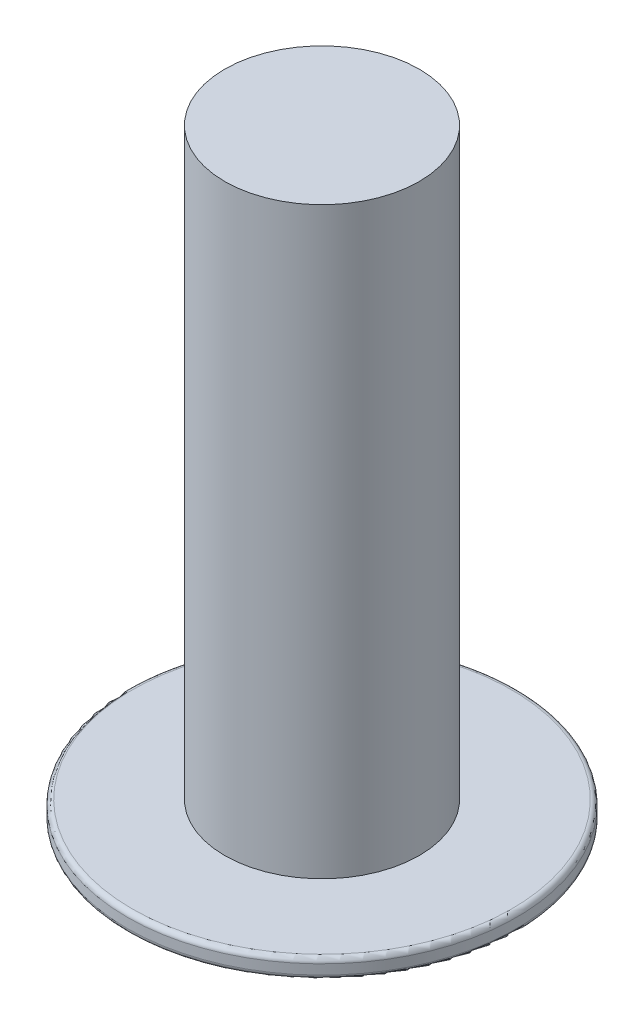
from build123d import *

# Parameters (mm, degrees)
SKETCH1_W          = 60
SKETCH1_H          = 10
CUT_EXTRUDE1_START = 1
CUT_EXTRUDE1_DEPTH = 10
FILLET1_R          = 0.5


with BuildPart() as part:
    # Sketch1 → Revolve1 (revolve)
    with BuildSketch(Plane.YZ, mode=Mode.PRIVATE) as revolve1_sk:
        with BuildLine():
            Line((-10, 0), (-2, 0))
            Line((-2, 0), (-2, 15))
            ThreePointArc((-2, 15), (-8.330111387, 8.742726073), (-10, 0))
        make_face()
        Polygon((0, 20), (0, 10), (0, 0), (-2, 0), (-2, 20), align=None)
        with Locations((30, 5)):
            Rectangle(SKETCH1_W, SKETCH1_H)
    revolve(revolve1_sk.sketch.rotate(Axis((0, -21.912032937, 0), (0, 1, 0)), 180), axis=Axis((0, -21.912032937, 0), (0, 1, 0)))

    # Sketch2 → Cut-Extrude1 (cut)
    with BuildSketch(Plane.XZ.offset(2).offset(CUT_EXTRUDE1_START)):
        Polygon((4, -6.92820323), (8, 0), (4, 6.92820323), (-4, 6.92820323), (-8, 0), (-4, -6.92820323), align=None)
    extrude(amount=CUT_EXTRUDE1_DEPTH, mode=Mode.SUBTRACT)

    # Fillet1
    fillet1_edges = [part.edges().sort_by_distance(p)[0] for p in [
        (-6, -9.148190897, -3.464101615),
        (-6, -9.148190897, 3.464101615),
        (0, -9.148190897, 6.92820323),
        (6, -9.148190897, 3.464101615),
        (6, -9.148190897, -3.464101615),
        (-2.012812506, -9.037939191, -6.92820323),
        (-4, -5.850108704, -6.92820323),
        (0, -3, -6.92820323),
        (4, -5.850108704, -6.92820323),
        (6, -3, -3.464101615),
        (8, -5.850108704, 0),
        (6, -3, 3.464101615),
        (4, -5.850108704, 6.92820323),
        (0, -3, 6.92820323),
        (-4, -5.850108704, 6.92820323),
        (-6, -3, 3.464101615),
        (-8, -5.850108704, 0),
        (-6, -3, -3.464101615),
        (0, -2, 20),
        (0, 0, 20),
    ]]
    fillet(fillet1_edges, radius=FILLET1_R)


solid = part.part
